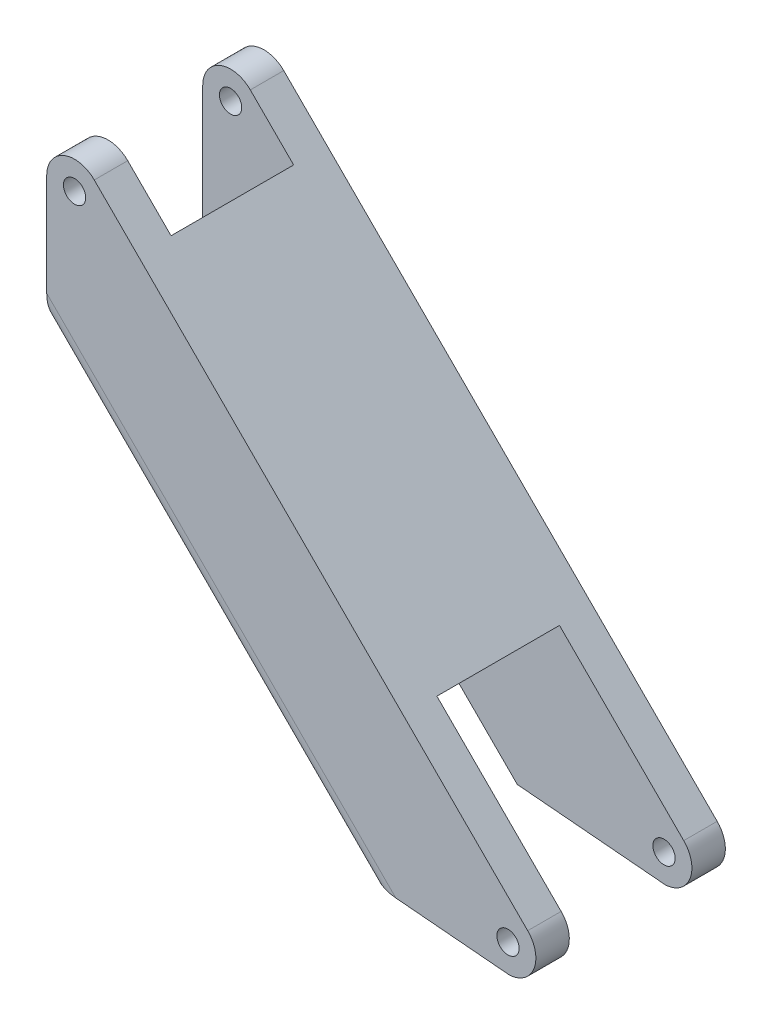
from build123d import *

# Parameters (mm, degrees)
SKETCH1_R           = 1
BOSS_EXTRUDE1_DEPTH = 17
SKETCH2_W           = 17.330300869
SKETCH2_H           = 11
CUT_EXTRUDE1_DEPTH  = 17
SKETCH3_W           = 11
SKETCH3_H           = 11.611712882
CUT_EXTRUDE2_DEPTH  = 64.45501819
SKETCH4_W           = 11
SKETCH4_H           = 15.767820388
BOSS_EXTRUDE2_DEPTH = 2
FILLET1_R           = 2


with BuildPart() as part:
    # Sketch1 → Boss-Extrude1 (new body)
    with BuildSketch(Plane.XY):
        with BuildLine():
            Line((-18.665536599, 40.94089641), (-5.023709167, 27.299068978))
            Line((-5.023709167, 27.299068978), (9.56111442, 12.714245391))
            Line((9.56111442, 12.714245391), (22.179931818, 11.610241922))
            Line((22.179931818, 11.610241922), (22.83879138, 11.552599179))
            ThreePointArc((22.83879138, 11.552599179), (25.056154475, 13.145984205), (24.49310332, 15.817790397))
            Line((24.49310332, 15.817790397), (5.517505351, 34.793388366))
            Line((5.517505351, 34.793388366), (-14.397769646, 54.708663363))
            ThreePointArc((-14.397769646, 54.708663363), (-17.12224518, 55.250595241), (-18.665536599, 52.94089641))
            Line((-18.665536599, 52.94089641), (-18.665536599, 40.94089641))
        make_face()
        with Locations((22.725336367, 14.050023445)):
            Circle(SKETCH1_R, mode=Mode.SUBTRACT)
        with Locations((-16.165536599, 52.94089641)):
            Circle(SKETCH1_R, mode=Mode.SUBTRACT)
    extrude(amount=BOSS_EXTRUDE1_DEPTH)

    # Sketch2 → Cut-Extrude1 (cut)
    with BuildSketch(Plane(origin=(20.155446858, 20.155446858, 0), x_dir=(0.7071067811865516, -0.7071067811865436, 0), z_dir=(0.7071067811865436, 0.7071067811865516, 0))):
        Polygon((-22.401268179, -3), (-25.401268179, -3), (-25.401268179, -14), (31.236683476, -14), (31.236683476, -3), align=None)
        with Locations((-52.031204615, -8.5)):
            Rectangle(SKETCH2_W, SKETCH2_H)
    extrude(amount=-CUT_EXTRUDE1_DEPTH, mode=Mode.SUBTRACT)

    # Sketch3 → Cut-Extrude2 (cut, through all)
    with BuildSketch(Plane(origin=(-30.664430984, 30.664430984, 0), x_dir=(0, 0, 1), z_dir=(-0.7071067811865515, 0.7071067811865437, 0))):
        with Locations((8.5, 18.430482909)):
            Rectangle(SKETCH3_W, SKETCH3_H)
    extrude(amount=-CUT_EXTRUDE2_DEPTH, mode=Mode.SUBTRACT)

    # Sketch4 → Boss-Extrude2 (add)
    with BuildSketch(Plane(origin=(20.155446858, 20.155446858, 0), x_dir=(0, 0, -1), z_dir=(0.7071067811865435, 0.7071067811865516, 0))):
        with Locations((-8.5, 17.517357985)):
            Rectangle(SKETCH4_W, SKETCH4_H)
    extrude(amount=-BOSS_EXTRUDE2_DEPTH)

    # Fillet1
    fillet1_edges = [part.edges().sort_by_distance(p)[0] for p in [
        (-4.55221109, 26.827570901, 17),
        (-4.55221109, 26.827570901, 0),
    ]]
    fillet(fillet1_edges, radius=FILLET1_R)


solid = part.part
